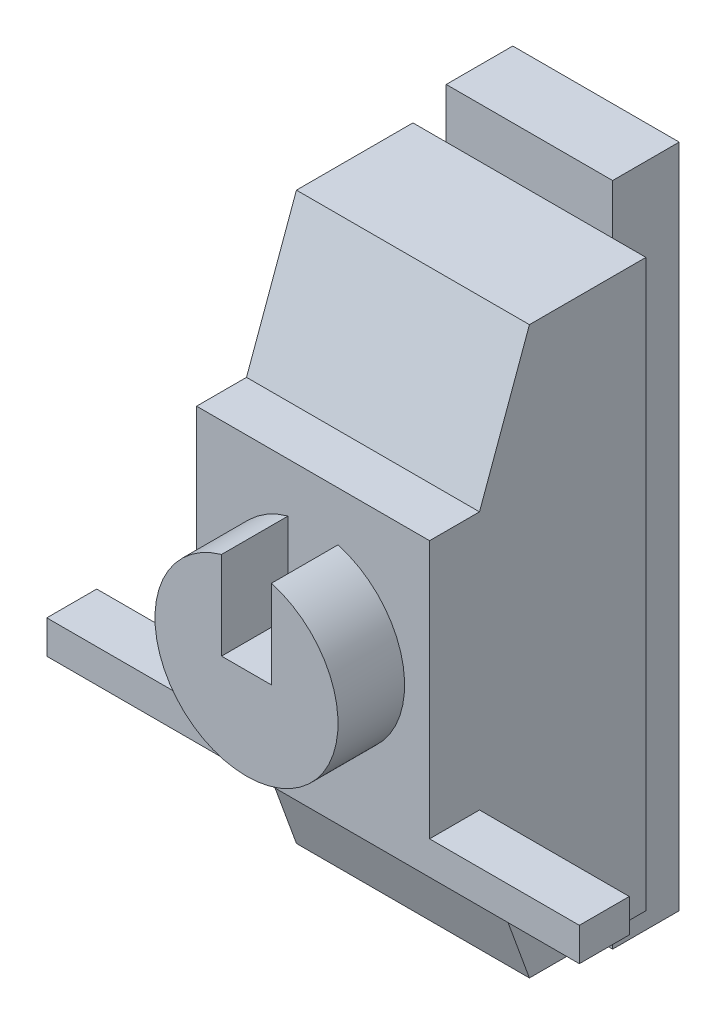
from build123d import *

# Parameters (mm, degrees)
SKETCH_1_W           = 10
SKETCH_1_H           = 40
EXTRUDE_1_DEPTH      = 4
EXTRUDE_2_DEPTH      = 7
EXTRUDE_2_DEPTH_BACK = 7
SKETCH_4_W           = 32
SKETCH_4_H           = 3
EXTRUDE_3_DEPTH      = 2
SKETCH_5_R           = 5.5
EXTRUDE_4_DEPTH      = 4
SKETCH_6_W           = 3
SKETCH_6_H           = 5.5
CUT_EXTRUDE_1_DEPTH  = 4


with BuildPart() as part:
    # Эскиз1 → Бобышка-Вытянуть1 (new body)
    with BuildSketch(Plane.XY):
        Rectangle(SKETCH_1_W, SKETCH_1_H)
    extrude(amount=EXTRUDE_1_DEPTH)

    # Эскиз3 → Бобышка-Вытянуть2 (add, two sides: drawn at the far end of the back side and taken through both)
    with BuildSketch(Plane(origin=(0, 0, 0), x_dir=(0, 0, -1), z_dir=(1, 0, 0)).offset(-EXTRUDE_2_DEPTH_BACK)):
        Polygon((-17, -8.757567742), (-17, 8.757567742), (-14, 8.757567742), (-11, 17), (-4, 17), (-4, -17), (-11, -17), (-14, -8.757567742), align=None)
    extrude(amount=EXTRUDE_2_DEPTH + EXTRUDE_2_DEPTH_BACK)

    # Эскиз4 → Бобышка-Вытянуть3 (add)
    with BuildSketch(Plane.XZ.offset(8.757567742)):
        with Locations((0, 15.5)):
            Rectangle(SKETCH_4_W, SKETCH_4_H)
    extrude(amount=-EXTRUDE_3_DEPTH)

    # Эскиз5 → Бобышка-Вытянуть4 (add)
    with BuildSketch(Plane.XY.offset(17)):
        with Locations(Location((0, 0.5, 0), (0, 0, 180))):
            Circle(SKETCH_5_R)
    extrude(amount=EXTRUDE_4_DEPTH)

    # Эскиз6 → Вырез-Вытянуть1 (cut)
    with BuildSketch(Plane.XY.offset(21)):
        with Locations((0, 3.25)):
            Rectangle(SKETCH_6_W, SKETCH_6_H)
    extrude(amount=-CUT_EXTRUDE_1_DEPTH, mode=Mode.SUBTRACT)


solid = part.part
